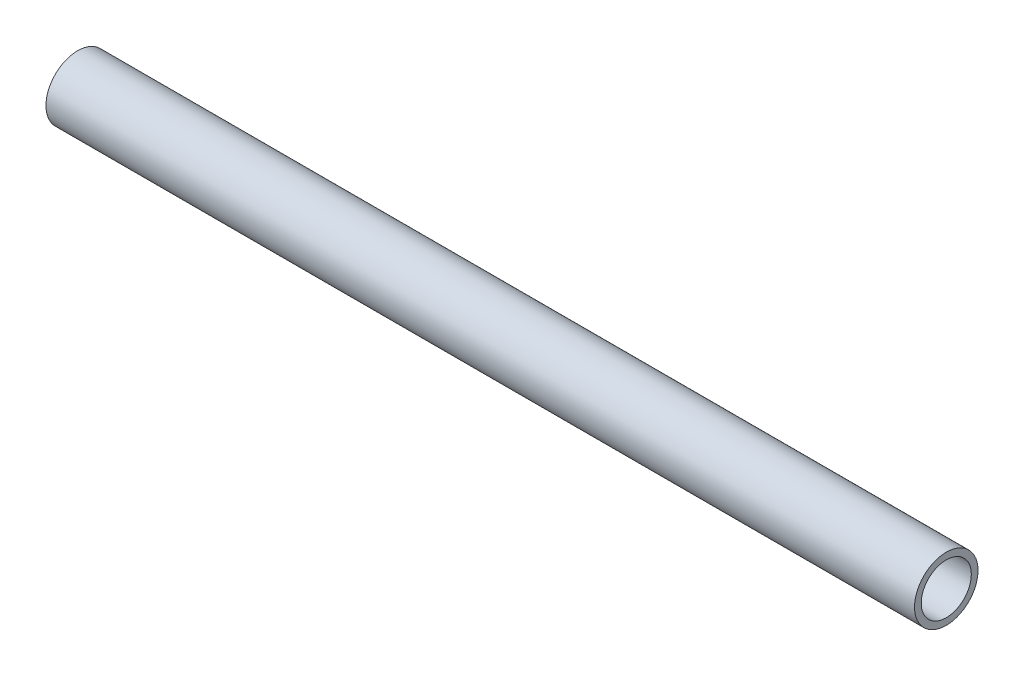
from build123d import *

# Parameters (mm, degrees)
CROQUIS1_R              = 19
CROQUIS1_R_2            = 15
SALIENTE_EXTRUIR1_DEPTH = 520


with BuildPart() as part:
    # Croquis1 → Saliente-Extruir1 (new body)
    with BuildSketch(Plane(origin=(0, 0, 0), x_dir=(0, 0, -1), z_dir=(1, 0, 0))):
        Circle(CROQUIS1_R)
        Circle(CROQUIS1_R_2, mode=Mode.SUBTRACT)
    extrude(amount=SALIENTE_EXTRUIR1_DEPTH)


solid = part.part
